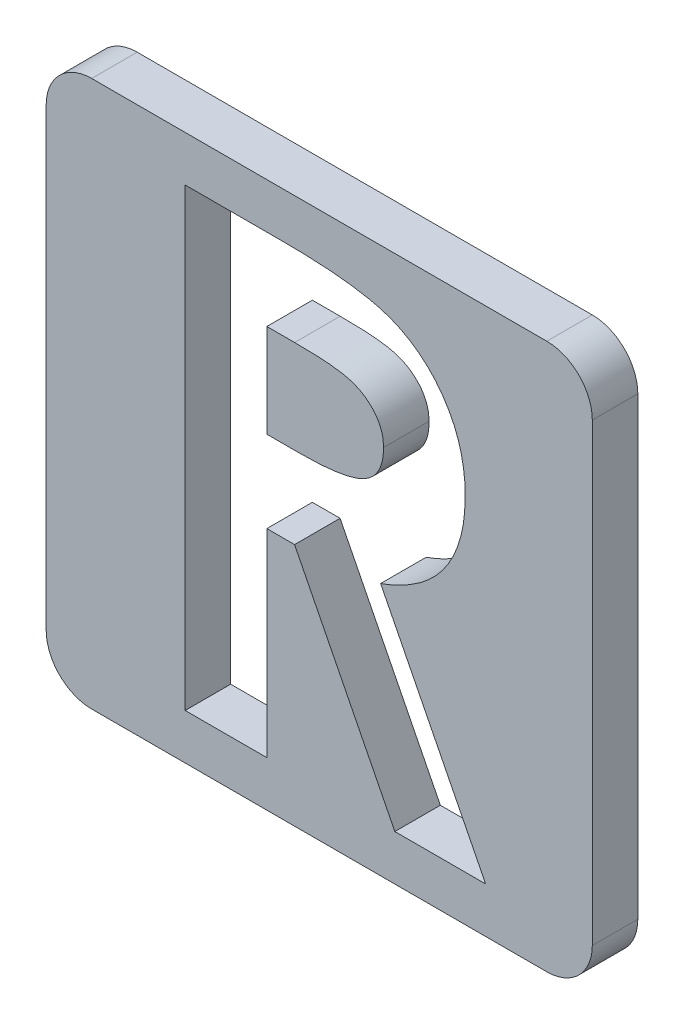
from build123d import *

# Parameters (mm, degrees)
BOSS_EXTRUDE1_DEPTH = 10
CUT_EXTRUDE31_DEPTH = 10


with BuildPart() as part:
    # Sketch1 → Boss-Extrude1 (new body)
    with BuildSketch(Plane.XY):
        with BuildLine():
            Line((-50, 60), (50, 60))
            ThreePointArc((50, 60), (57.071067812, 57.071067812), (60, 50))
            Line((60, 50), (60, -50))
            ThreePointArc((60, -50), (57.071067812, -57.071067812), (50, -60))
            Line((50, -60), (-50, -60))
            ThreePointArc((-50, -60), (-57.071067812, -57.071067812), (-60, -50))
            Line((-60, -50), (-60, 50))
            ThreePointArc((-60, 50), (-57.071067812, 57.071067812), (-50, 60))
        make_face()
    extrude(amount=BOSS_EXTRUDE1_DEPTH)

    # Sketch2 → Cut-Extrude31 (cut)
    with BuildSketch(Plane.XY.offset(10)):
        with BuildLine():
            Line((-29.461538462, 50), (-8.548076923, 50))
            add(Edge.make_bspline(
                [(-8.548076923, 50), (-7.165703481, 49.995093368), (-4.507009959, 49.985656532), (-0.673319115, 49.836768254), (2.848453144, 49.629577996), (6.06352112, 49.313400163), (8.970509353, 48.894186574), (11.572331327, 48.400003124), (13.868910992, 47.836775133), (15.879616825, 47.134948618), (17.694179412, 46.34329895), (19.385604016, 45.433678965), (20.991205978, 44.41621757), (22.500253584, 43.264142601), (23.925860812, 41.998179603), (25.270717156, 40.617054259), (26.515818548, 39.109055197), (27.653455271, 37.483711056), (28.690319571, 35.77388629), (29.606690143, 33.977233301), (30.351884216, 32.092502634), (31.010343063, 30.146932723), (31.484609638, 28.112711264), (31.814455103, 26.009641747), (32.055955049, 23.830321144), (32.069840141, 22.349787486), (32.076923077, 21.594551282)],
                knots=[0, 0, 0, 0, 1.749336639, 3.364467119, 4.854658419, 6.213483162, 7.451590619, 8.570285859, 9.5643256, 10.440900261, 11.26203566, 12.067320669, 12.869050712, 13.665104639, 14.467235401, 15.27997916, 16.102287765, 16.939272006, 17.78853747, 18.631303466, 19.488103222, 20.351255419, 21.228522269, 22.127379805, 23.044756219, 24, 24, 24, 24], degree=3))
            add(Edge.make_bspline(
                [(32.076923077, 21.594551282), (32.058524158, 20.80625818), (32.02244723, 19.260559079), (31.828117272, 16.990053166), (31.472943153, 14.817791924), (30.93498028, 12.750135467), (30.316661832, 10.761349398), (29.494456904, 8.888128065), (28.566517379, 7.103228176), (27.464430716, 5.431897819), (26.254944445, 3.837013405), (24.848337353, 2.379680875), (23.335735975, 0.981574121), (21.632111478, -0.269734192), (19.812561212, -1.45885301), (17.840932629, -2.536511333), (15.730093252, -3.529799011), (14.246068635, -4.083724833), (13.487179487, -4.366987179)],
                knots=[0, 0, 0, 0, 1.099860209, 2.156625411, 3.176576793, 4.16617041, 5.135385252, 6.078461593, 7.016046972, 7.938469504, 8.868247731, 9.803980173, 10.76021508, 11.73834243, 12.748633912, 13.790971185, 14.870363756, 16, 16, 16, 16], degree=3))
            Line((13.487179487, -4.366987179), (36.564102564, -50))
            Line((36.564102564, -50), (16.612179487, -50))
            Line((16.612179487, -50), (-5.423076923, -6.41025641))
            Line((-5.423076923, -6.41025641), (-11.512820513, -6.41025641))
            Line((-11.512820513, -6.41025641), (-11.512820513, -50))
            Line((-11.512820513, -50), (-29.461538462, -50))
            Line((-29.461538462, -50), (-29.461538462, 50))
        make_face()
        with BuildLine():
            Line((-11.512820513, 11.538461538), (-4.521634615, 11.538461538))
            add(Edge.make_bspline(
                [(-4.521634615, 11.538461538), (-3.666904025, 11.548088089), (-2.030278604, 11.566520864), (0.323403709, 11.652019718), (2.461108572, 11.858029706), (4.392016012, 12.118315626), (6.12584218, 12.418853311), (7.647121957, 12.849542059), (8.979295943, 13.311035956), (10.106577827, 13.884553157), (11.069701566, 14.536766606), (11.901297271, 15.277697296), (12.589146155, 16.135230226), (13.155280872, 17.086061349), (13.59567213, 18.138600533), (13.917124011, 19.281293282), (14.096768077, 20.527156336), (14.117436738, 21.386971484), (14.128205128, 21.834935897)],
                knots=[0, 0, 0, 0, 1.688639943, 3.233382647, 4.650958383, 5.928841754, 7.082724185, 8.122798841, 9.049171256, 9.863274652, 10.613301712, 11.341792392, 12.054588806, 12.776240173, 13.521029143, 14.301969904, 15.115324896, 16, 16, 16, 16], degree=3))
            add(Edge.make_bspline(
                [(14.128205128, 21.834935897), (14.1078465, 22.364910501), (14.067855748, 23.405947401), (13.67102325, 24.904675503), (13.03935163, 26.291850903), (12.173502851, 27.561205998), (11.083078881, 28.6740103), (9.831731343, 29.654956154), (8.392453139, 30.430614737), (7.059789828, 30.94223088), (5.847377715, 31.248336096), (4.753214033, 31.476442996), (3.486165902, 31.638108903), (2.04527677, 31.809584375), (0.434219512, 31.920777538), (-1.355787098, 32.001926384), (-3.319602174, 32.035128363), (-4.688567797, 32.045742451), (-5.403044872, 32.051282051)],
                knots=[0, 0, 0, 0, 1.020303359, 2.004196876, 2.966617323, 3.9489082, 4.950758222, 5.960522915, 7.003732012, 8.091992268, 8.70421221, 9.413913587, 10.24622431, 11.166358409, 12.212345909, 13.359657661, 14.621978493, 16, 16, 16, 16], degree=3))
            Line((-5.403044872, 32.051282051), (-11.512820513, 32.051282051))
            Line((-11.512820513, 32.051282051), (-11.512820513, 11.538461538))
        make_face(mode=Mode.SUBTRACT)
    extrude(amount=-CUT_EXTRUDE31_DEPTH, mode=Mode.SUBTRACT)


with BuildPart() as cut_extrude31_piece_1:
    # of the separate pieces the step leaves, piece 1, a body of its own (cut_extrude31_pieces)
    add(part.part.solids().sort_by_distance((-50, 60, 0))[0])


with BuildPart() as cut_extrude31_piece_2:
    # of the separate pieces the step leaves, piece 2, a body of its own (cut_extrude31_pieces)
    add(part.part.solids().sort_by_distance((-11.512820513, 11.538461538, 0))[0])


solid = Compound([cut_extrude31_piece_1.part, cut_extrude31_piece_2.part])
